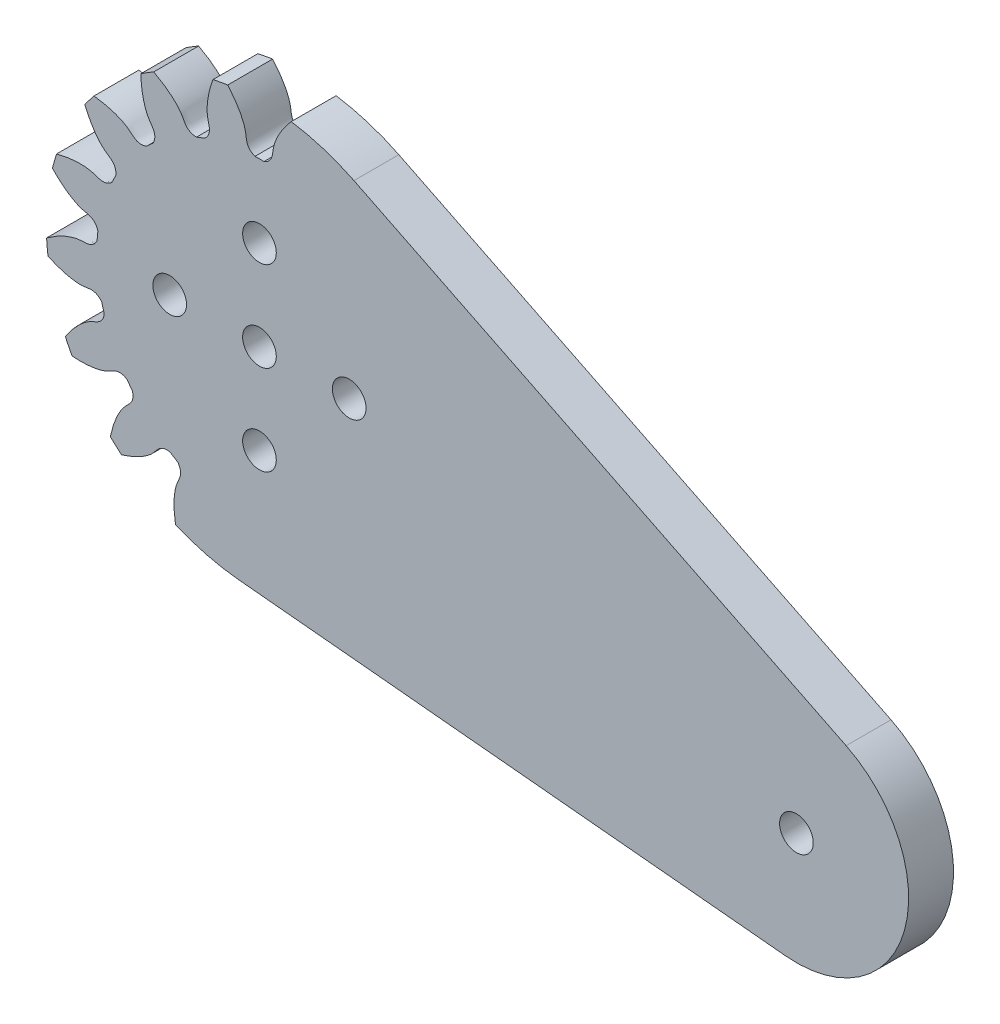
from build123d import *

# Parameters (mm, degrees)
SKETCH_1_R               = 19
EXTRUDE_1_DEPTH          = 4
CUT_EXTRUDE_1_DEPTH      = 28.166155414
PATTERN_CIRCULAR_1_COUNT = 8
PATTERN_CIRCULAR_1_ANGLE = 148.235294118
SKETCH_4_R               = 1
CUT_EXTRUDE_2_DEPTH      = 10
SKETCH_5_R               = 1.5
CUT_EXTRUDE_3_DEPTH      = 10
SKETCH_6_R               = 1
EXTRUDE_2_DEPTH          = 4
EXTRUDE_3_DEPTH          = 4
SKETCH_8_R               = 1.5
CUT_EXTRUDE_4_DEPTH      = 10
SKETCH_9_R               = 1.5
CUT_EXTRUDE_5_DEPTH      = 10


with BuildPart() as part:
    # 草图1 → 凸台-拉伸1 (new body)
    with BuildSketch(Plane.XY):
        Circle(SKETCH_1_R)
    extrude(amount=EXTRUDE_1_DEPTH)

    # 草图2 → 切除-拉伸1 (cut, through all)
    with BuildSketch(Plane.XY):
        with BuildLine():
            ThreePointArc((0.403387494, 14.494387829), (0, 14.5), (-0.403387494, 14.494387829))
            add(Edge.make_bspline(
                [(-0.403387494, 14.494387829), (-1.255759481, 14.849644042), (-1.132390756, 15.509626813), (-1.276611209, 16.129648275), (-1.289951469, 16.18230119), (-1.306037005, 16.240838627), (-1.32510118, 16.305170665), (-1.347383555, 16.375198727), (-1.373118159, 16.450817515), (-1.40253689, 16.531914502), (-1.435868224, 16.618370188), (-1.473337358, 16.710058129), (-1.515165928, 16.80684504), (-1.561571855, 16.908590882), (-1.612769151, 17.015148962), (-1.66896775, 17.12636603), (-1.730373323, 17.242082389), (-1.797187111, 17.362132), (-1.869605751, 17.4863426), (-1.947821109, 17.61453582), (-2.032020115, 17.746527309), (-2.1223846, 17.882126855), (-2.219091138, 18.021138524), (-2.32231089, 18.163360791), (-2.432209452, 18.308586678), (-2.548946705, 18.456603899), (-2.67267667, 18.607195006), (-2.803547366, 18.760137539), (-2.941700674, 18.915204179), (-3.087272199, 19.072162909), (-3.24039114, 19.23077717), (-3.401180166, 19.390806026), (-3.569755292, 19.552004336), (-3.746225758, 19.71412292), (-3.930693918, 19.876908731), (-4.123255131, 20.040105038), (-4.323997649, 20.203451599), (-4.533002522, 20.366684847), (-4.750343497, 20.529538073), (-4.976086928, 20.691741613), (-5.210291694, 20.853023038), (-5.453009069, 21.013107349), (-5.79164327, 21.226861067), (-6.053153804, 21.381051942), (-6.231291666, 21.481438237)],
                knots=[0, 0, 0, 0, 0.193882922, 0.199023975, 0.204850501, 0.211362501, 0.218559975, 0.226442923, 0.235011345, 0.24426524, 0.254204608, 0.264829451, 0.276139767, 0.288135557, 0.300816821, 0.314183558, 0.328235769, 0.342973453, 0.358396612, 0.374505244, 0.39129935, 0.408778929, 0.426943982, 0.445794509, 0.46533051, 0.485551984, 0.506458932, 0.528051354, 0.550329249, 0.573292619, 0.596941461, 0.621275778, 0.646295568, 0.672000832, 0.69839157, 0.725467781, 0.753229466, 0.781676625, 0.810809257, 0.840627364, 0.871130943, 0.902319997, 0.934194524, 1, 1, 1, 1], degree=3))
            ThreePointArc((-6.231291666, 21.481438237), (0, 22.366966369), (6.231291666, 21.481438237))
            add(Edge.make_bspline(
                [(0.403387494, 14.494387829), (1.255759481, 14.849644042), (1.132390756, 15.509626813), (1.276611209, 16.129648275), (1.289951469, 16.18230119), (1.306037005, 16.240838627), (1.32510118, 16.305170665), (1.347383555, 16.375198727), (1.373118159, 16.450817515), (1.40253689, 16.531914502), (1.435868224, 16.618370188), (1.473337358, 16.710058129), (1.515165928, 16.80684504), (1.561571855, 16.908590882), (1.612769151, 17.015148962), (1.66896775, 17.12636603), (1.730373323, 17.242082389), (1.797187111, 17.362132), (1.869605751, 17.4863426), (1.947821109, 17.61453582), (2.032020115, 17.746527309), (2.1223846, 17.882126855), (2.219091138, 18.021138524), (2.32231089, 18.163360791), (2.432209452, 18.308586678), (2.548946705, 18.456603899), (2.67267667, 18.607195006), (2.803547366, 18.760137539), (2.941700674, 18.915204179), (3.087272199, 19.072162909), (3.24039114, 19.23077717), (3.401180166, 19.390806026), (3.569755292, 19.552004336), (3.746225758, 19.71412292), (3.930693918, 19.876908731), (4.123255131, 20.040105038), (4.323997649, 20.203451599), (4.533002522, 20.366684847), (4.750343497, 20.529538073), (4.976086928, 20.691741613), (5.210291694, 20.853023038), (5.453009069, 21.013107349), (5.79164327, 21.226861067), (6.053153804, 21.381051942), (6.231291666, 21.481438237)],
                knots=[0, 0, 0, 0, 0.193882922, 0.199023975, 0.204850501, 0.211362501, 0.218559975, 0.226442923, 0.235011345, 0.24426524, 0.254204608, 0.264829451, 0.276139767, 0.288135557, 0.300816821, 0.314183558, 0.328235769, 0.342973453, 0.358396612, 0.374505244, 0.39129935, 0.408778929, 0.426943982, 0.445794509, 0.46533051, 0.485551984, 0.506458932, 0.528051354, 0.550329249, 0.573292619, 0.596941461, 0.621275778, 0.646295568, 0.672000832, 0.69839157, 0.725467781, 0.753229466, 0.781676625, 0.810809257, 0.840627364, 0.871130943, 0.902319997, 0.934194524, 1, 1, 1, 1], degree=3))
        make_face()
    cut_extrude_1 = extrude(amount=CUT_EXTRUDE_1_DEPTH, mode=Mode.SUBTRACT)

    # 阵列(圆周)1: 切除-拉伸1 ×8 about axis
    pattern_circular_1_axis = Axis((0, 0, -0.2), (0, 0, 1))
    for i in range(1, PATTERN_CIRCULAR_1_COUNT):
        add(cut_extrude_1.rotate(pattern_circular_1_axis, i * PATTERN_CIRCULAR_1_ANGLE / (PATTERN_CIRCULAR_1_COUNT - 1)), mode=Mode.SUBTRACT)

    # 草图4 → 切除-拉伸2 (cut)
    with BuildSketch(Plane.XY.offset(4)):
        Circle(SKETCH_4_R)
    extrude(amount=-CUT_EXTRUDE_2_DEPTH, mode=Mode.SUBTRACT)

    # 草图5 → 切除-拉伸3 (cut)
    with BuildSketch(Plane.XY.offset(4)):
        with Locations((0, 8)):
            Circle(SKETCH_5_R)
        with Locations((8, 0)):
            Circle(SKETCH_5_R)
        with Locations((0, -8)):
            Circle(SKETCH_5_R)
        with Locations((-8, 0)):
            Circle(SKETCH_5_R)
    extrude(amount=-CUT_EXTRUDE_3_DEPTH, mode=Mode.SUBTRACT)

    # 草图6 → 凸台-拉伸2 (add)
    with BuildSketch(Plane.XY.offset(4)):
        Circle(SKETCH_6_R)
    extrude(amount=-EXTRUDE_2_DEPTH)

    # 草图7 → 凸台-拉伸3 (add)
    with BuildSketch(Plane(origin=(0, 0, 0), x_dir=(-1, 0, 0), z_dir=(0, 0, -1))):
        with BuildLine():
            Line((-8.419780478, 17.032536414), (-52.282289157, -4.650240906))
            ThreePointArc((-52.282289157, -4.650240906), (-57.46908218, -16.351363657), (-46.899334515, -23.569364057))
            Line((-46.899334515, -23.569364057), (1.807833343, -18.913797572))
            ThreePointArc((1.807833343, -18.913797572), (-18.27468722, -5.199596811), (-8.419780478, 17.032536414))
        make_face()
    extrude(amount=-EXTRUDE_3_DEPTH)

    # 草图8 → 切除-拉伸4 (cut)
    with BuildSketch(Plane(origin=(0, 0, 0), x_dir=(-1, 0, 0), z_dir=(0, 0, -1))):
        with Locations((-47.850825748, -13.614733756)):
            Circle(SKETCH_8_R)
    extrude(amount=-CUT_EXTRUDE_4_DEPTH, mode=Mode.SUBTRACT)

    # 草图9 → 切除-拉伸5 (cut)
    with BuildSketch(Plane(origin=(0, 0, 0), x_dir=(-1, 0, 0), z_dir=(0, 0, -1))):
        Circle(SKETCH_9_R)
    extrude(amount=-CUT_EXTRUDE_5_DEPTH, mode=Mode.SUBTRACT)


solid = part.part
